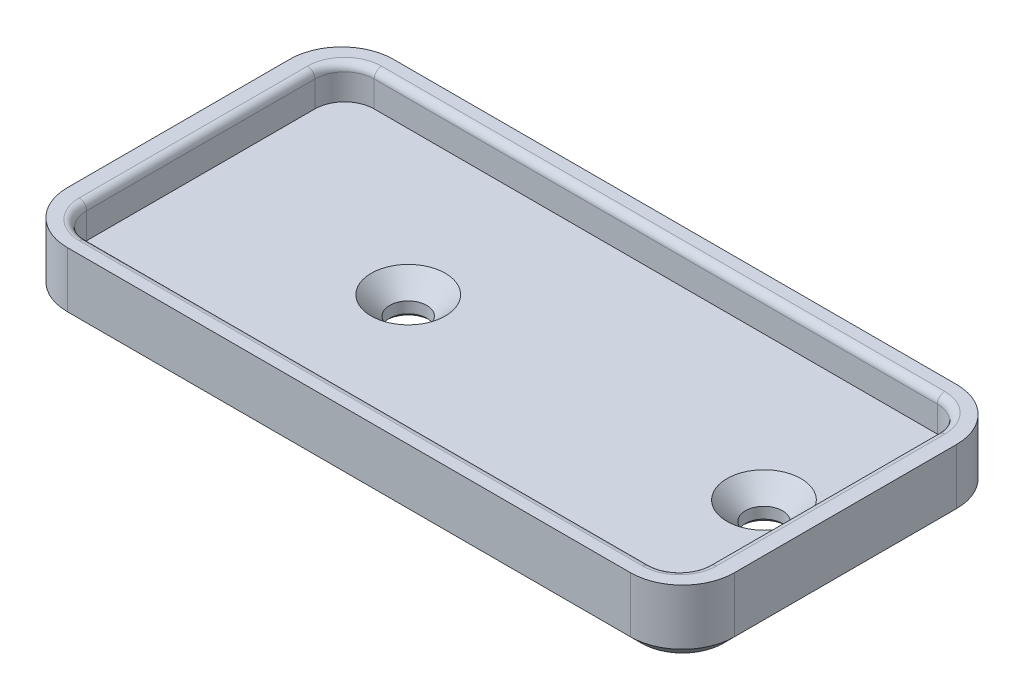
from build123d import *

# Parameters (mm, degrees)
SKETCH_1_W          = 90
SKETCH_1_H          = 44
EXTRUDE_1_DEPTH     = 9
FILLET_1_R          = 7
SKETCH_2_W          = 84
SKETCH_2_H          = 38.8
CUT_EXTRUDE_1_DEPTH = 4.5
SKETCH_3_R          = 2.5
CUT_EXTRUDE_2_DEPTH = 10
CHAMFER_1_SIZE      = 2.5
FILLET_2_R          = 4
FILLET_3_R          = 1
CHAMFER_4_SIZE      = 1.5
CHAMFER_2_SIZE      = 0.5


with BuildPart() as part:
    # Эскиз1 → Бобышка-Вытянуть1 (new body)
    with BuildSketch(Plane(origin=(0, 0, 0), x_dir=(1, 0, 0), z_dir=(0, 1, 0))):
        Rectangle(SKETCH_1_W, SKETCH_1_H)
    extrude(amount=EXTRUDE_1_DEPTH)

    # Скругление1
    fillet_1_edges = [part.edges().sort_by_distance(p)[0] for p in [
        (45, 4.5, 22),
        (-45, 4.5, 22),
        (-45, 4.5, -22),
        (45, 4.5, -22),
    ]]
    fillet(fillet_1_edges, radius=FILLET_1_R)

    # Эскиз2 → Вырез-Вытянуть1 (cut)
    with BuildSketch(Plane(origin=(0, 9, 0), x_dir=(1, 0, 0), z_dir=(0, 1, 0))):
        Rectangle(SKETCH_2_W, SKETCH_2_H)
    extrude(amount=-CUT_EXTRUDE_1_DEPTH, mode=Mode.SUBTRACT)

    # Эскиз3 → Вырез-Вытянуть2 (cut)
    with BuildSketch(Plane(origin=(0, 4.5, 0), x_dir=(1, 0, 0), z_dir=(0, 1, 0))):
        with Locations(Location((34, 0, 0), (0, 0, 270))):
            Circle(SKETCH_3_R)
        with Locations(Location((-14, 0, 0), (0, 0, 90))):
            Circle(SKETCH_3_R)
    extrude(amount=-CUT_EXTRUDE_2_DEPTH, mode=Mode.SUBTRACT)

    # Фаска1
    chamfer_1_edges = [part.edges().sort_by_distance(p)[0] for p in [
        (34, 4.5, -2.5),
        (-14, 4.5, 2.5),
    ]]
    chamfer(chamfer_1_edges, length=CHAMFER_1_SIZE)

    # Скругление2
    fillet_2_edges = [part.edges().sort_by_distance(p)[0] for p in [
        (42, 6.75, -19.4),
        (42, 6.75, 19.4),
        (-42, 6.75, 19.4),
        (-42, 6.75, -19.4),
    ]]
    fillet(fillet_2_edges, radius=FILLET_2_R)

    # Скругление3
    fillet_3_edges = [part.edges().sort_by_distance(p)[0] for p in [
        (0, 9, 19.4),
        (-42, 9, 0),
        (42, 9, 0),
        (0, 9, -19.4),
        (-40.828427125, 9, 18.228427125),
        (40.828427125, 9, 18.228427125),
        (40.828427125, 9, -18.228427125),
        (-40.828427125, 9, -18.228427125),
    ]]
    fillet(fillet_3_edges, radius=FILLET_3_R)

    # Chamfer 4
    chamfer_4_edges = [part.edges().sort_by_distance(p)[0] for p in [
        (-45, 0, 0),
        (45, 0, 0),
        (0, 0, 22),
        (0, 0, -22),
        (42.949747468, 0, 19.949747468),
        (42.949747468, 0, -19.949747468),
        (-42.949747468, 0, 19.949747468),
        (-42.949747468, 0, -19.949747468),
    ]]
    chamfer(chamfer_4_edges, length=CHAMFER_4_SIZE)

    # Фаска2
    chamfer_2_edges = [part.edges().sort_by_distance(p)[0] for p in [
        (34, 0, -2.5),
        (-14, 0, 2.5),
    ]]
    chamfer(chamfer_2_edges, length=CHAMFER_2_SIZE)


solid = part.part
